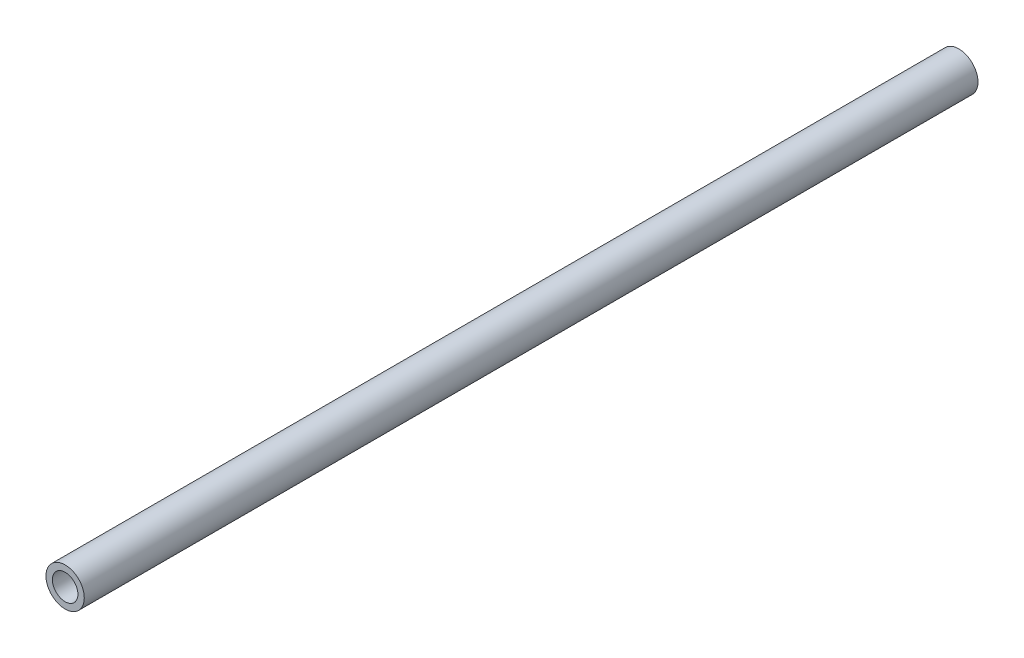
from build123d import *

# Parameters (mm, degrees)
F_1_FR_R        = 15
F_1_FR_R_2      = 10
EXTRUDE_1_DEPTH = 700


with BuildPart() as part:
    # Эскиз1_fr → Бобышка-Вытянуть1 (new body)
    with BuildSketch(Plane.XY):
        Circle(F_1_FR_R)
        Circle(F_1_FR_R_2, mode=Mode.SUBTRACT)
    extrude(amount=EXTRUDE_1_DEPTH)


solid = part.part
